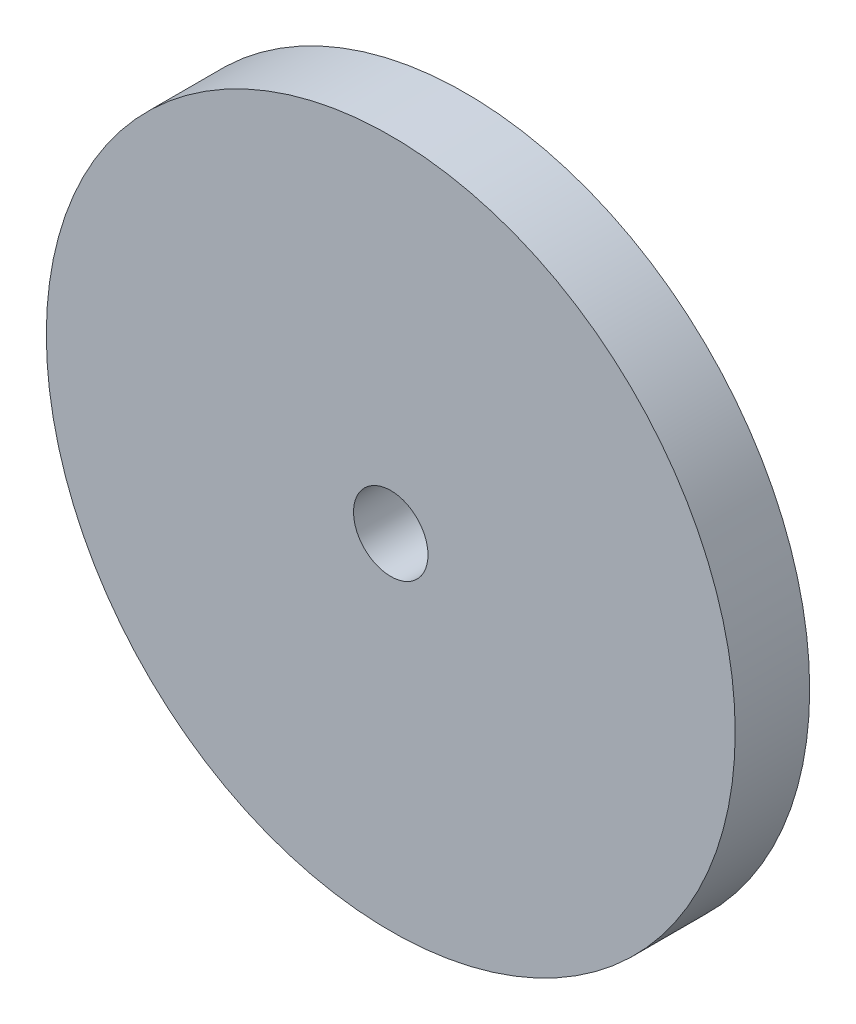
from build123d import *

# Parameters (mm, degrees)
SKETCH2_R           = 18.5
SKETCH2_R_2         = 2
BOSS_EXTRUDE1_DEPTH = 4


with BuildPart() as part:
    # Sketch2 → Boss-Extrude1 (new body)
    with BuildSketch(Plane.XY):
        Circle(SKETCH2_R)
        Circle(SKETCH2_R_2, mode=Mode.SUBTRACT)
    extrude(amount=BOSS_EXTRUDE1_DEPTH)


solid = part.part
